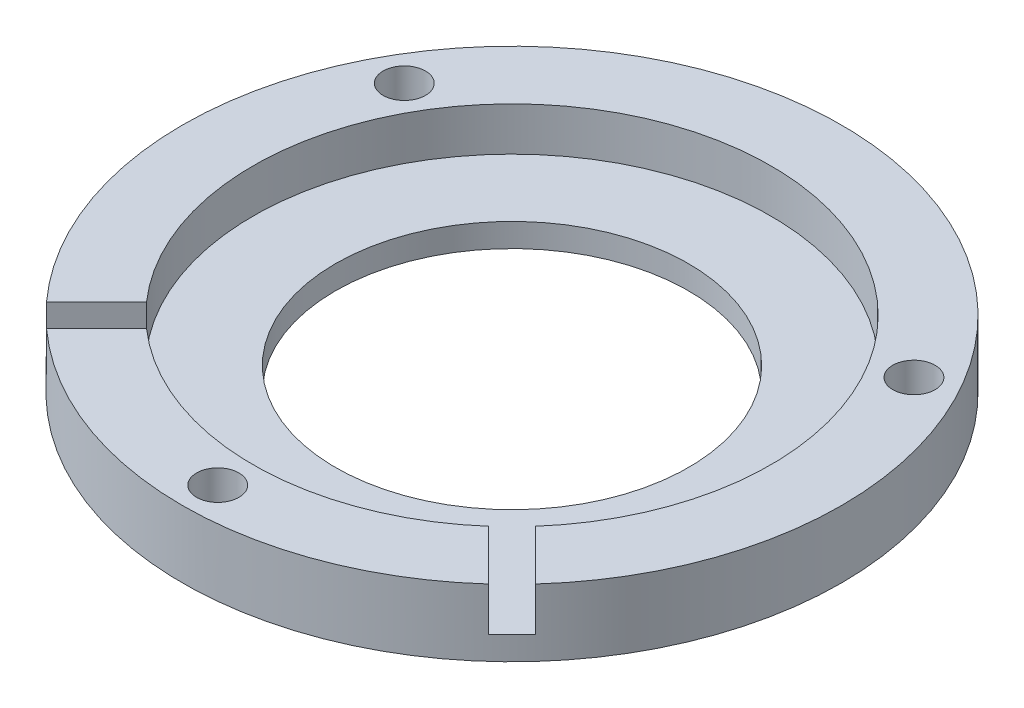
from build123d import *

# Parameters (mm, degrees)
CUT_EXTRUDE1_DEPTH = 1.85
SKETCH4_R          = 0.9
CUT_EXTRUDE2_DEPTH = 21.003062266


with BuildPart() as part:
    # Sketch1 → Revolve1 (revolve)
    with BuildSketch(Plane.XY, mode=Mode.PRIVATE) as revolve1_sk:
        Polygon((7.5, 1), (7.5, 0), (14, 0), (14, 2.85), (11, 2.85), (11, 1), align=None)
    revolve(revolve1_sk.sketch.rotate(Axis((0, 1, 0), (0, -1, 0)), 180), axis=Axis((0, 1, 0), (0, -1, 0)))

    # Sketch2 → Cut-Extrude1 (cut)
    with BuildSketch(Plane(origin=(0, 2.85, 0), x_dir=(1, 0, 0), z_dir=(0, 1, 0))):
        with BuildLine():
            ThreePointArc((-7.267434673, -8.257384167), (-7.526619427, -8.021845174), (-7.778174593, -7.778174593))
            Line((-7.778174593, -7.778174593), (-9.899494937, -9.899494937))
            ThreePointArc((-9.899494937, -9.899494937), (-9.648834126, -10.143963722), (-9.392138077, -10.382087571))
            Line((-9.392138077, -10.382087571), (-7.267434673, -8.257384167))
        make_face()
        with BuildLine():
            Line((-9.899494937, -9.899494937), (-7.778174593, -7.778174593))
            ThreePointArc((-7.778174593, -7.778174593), (-8.021845174, -7.526619427), (-8.257384167, -7.267434673))
            Line((-8.257384167, -7.267434673), (-10.382087571, -9.392138077))
            ThreePointArc((-10.382087571, -9.392138077), (-10.143963722, -9.648834126), (-9.899494937, -9.899494937))
        make_face()
        with BuildLine():
            Line((10.382087571, -9.392138077), (8.257384167, -7.267434673))
            ThreePointArc((8.257384167, -7.267434673), (7.778174593, -7.778174593), (7.267434673, -8.257384167))
            Line((7.267434673, -8.257384167), (9.392138077, -10.382087571))
            ThreePointArc((9.392138077, -10.382087571), (9.648834126, -10.143963722), (9.899494937, -9.899494937))
            ThreePointArc((9.899494937, -9.899494937), (10.143963722, -9.648834126), (10.382087571, -9.392138077))
        make_face()
    extrude(amount=-CUT_EXTRUDE1_DEPTH, mode=Mode.SUBTRACT)

    # Sketch4 → Cut-Extrude2 (cut, through all)
    with BuildSketch(Plane(origin=(0, 2.85, 0), x_dir=(1, 0, 0), z_dir=(0, 1, 0))):
        with Locations(Location((-10.825317547, 6.25, 0), (0, 0, 180))):
            Circle(SKETCH4_R)
        with Locations(Location((10.825317547, 6.25, 0), (0, 0, 180))):
            Circle(SKETCH4_R)
        with Locations(Location((0, -12.5, 0), (0, 0, 180))):
            Circle(SKETCH4_R)
    extrude(amount=-CUT_EXTRUDE2_DEPTH, mode=Mode.SUBTRACT)


solid = part.part
